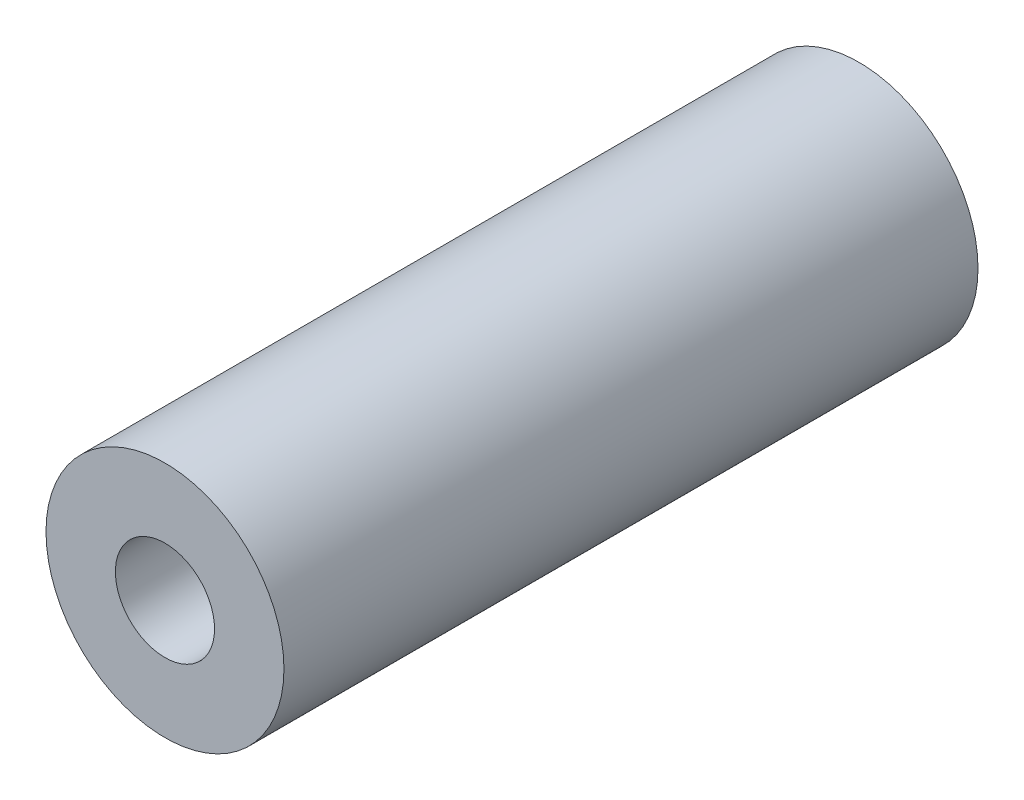
from build123d import *

# Parameters (mm, degrees)
SKETCH1_R           = 12
SKETCH1_R_2         = 5
BOSS_EXTRUDE1_DEPTH = 70


with BuildPart() as part:
    # Sketch1 → Boss-Extrude1 (new body)
    with BuildSketch(Plane.XY):
        Circle(SKETCH1_R)
        Circle(SKETCH1_R_2, mode=Mode.SUBTRACT)
    extrude(amount=BOSS_EXTRUDE1_DEPTH)


solid = part.part
